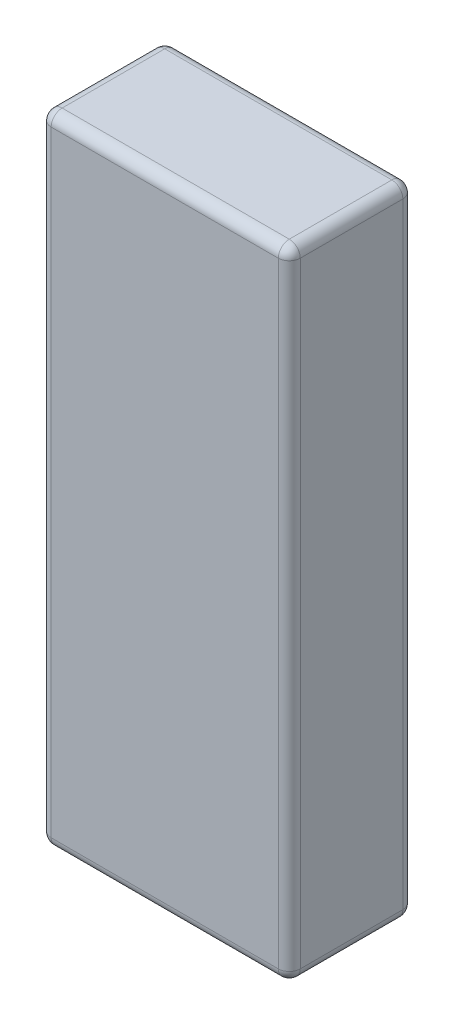
from build123d import *

# Parameters (mm, degrees)
SKETCH1_W           = 34
SKETCH1_H           = 87
BOSS_EXTRUDE1_DEPTH = 17
FILLET1_R           = 1.5


with BuildPart() as part:
    # Sketch1 → Boss-Extrude1 (new body)
    with BuildSketch(Plane.XY):
        with Locations((17, 43.5)):
            Rectangle(SKETCH1_W, SKETCH1_H)
    extrude(amount=BOSS_EXTRUDE1_DEPTH)

    # Fillet1
    fillet1_edges = [part.edges().sort_by_distance(p)[0] for p in [
        (34, 43.5, 17),
        (17, 87, 17),
        (0, 43.5, 17),
        (17, 87, 0),
        (34, 43.5, 0),
        (17, 0, 0),
        (0, 43.5, 0),
        (17, 0, 17),
        (0, 87, 8.5),
        (34, 87, 8.5),
        (34, 0, 8.5),
        (0, 0, 8.5),
    ]]
    fillet(fillet1_edges, radius=FILLET1_R)


solid = part.part
